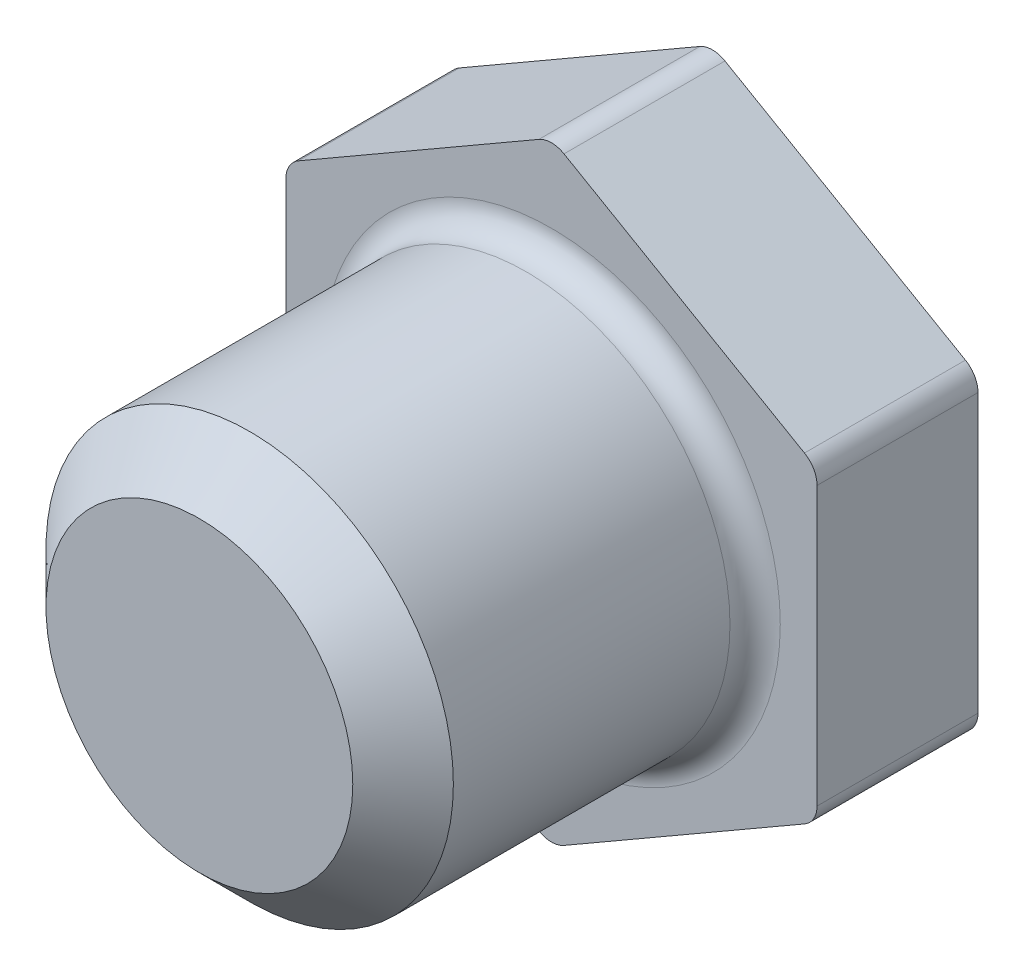
from build123d import *

# Parameters (mm, degrees)
BOSS_EXTRUDE1_DEPTH = 3.2
SKETCH2_R           = 4.05
BOSS_EXTRUDE2_DEPTH = 7
FILLET1_R           = 0.5
CHAMFER1_SIZE       = 1


with BuildPart() as part:
    # Sketch1 → Boss-Extrude1 (new body)
    with BuildSketch(Plane.XY):
        Polygon((5.281312122, 3.049166975), (0, 6.09833395), (-5.281312122, 3.049166975), (-5.281312122, -3.049166975), (0, -6.09833395), (5.281312122, -3.049166975), align=None)
    extrude(amount=BOSS_EXTRUDE1_DEPTH)

    # Sketch2 → Boss-Extrude2 (add)
    with BuildSketch(Plane.XY.offset(3.2)):
        Circle(SKETCH2_R)
    extrude(amount=BOSS_EXTRUDE2_DEPTH)

    # Fillet1
    fillet1_edges = [part.edges().sort_by_distance(p)[0] for p in [
        (5.281312122, -3.049166975, 1.6),
        (0, -6.09833395, 1.6),
        (-5.281312122, -3.049166975, 1.6),
        (-5.281312122, 3.049166975, 1.6),
        (0, 6.09833395, 1.6),
        (5.281312122, 3.049166975, 1.6),
        (-4.05, 0, 3.2),
    ]]
    fillet(fillet1_edges, radius=FILLET1_R)

    # Chamfer1
    chamfer1_edges = [part.edges().sort_by_distance(p)[0] for p in [
        (-4.05, 0, 10.2),
    ]]
    chamfer(chamfer1_edges, length=CHAMFER1_SIZE)


solid = part.part
